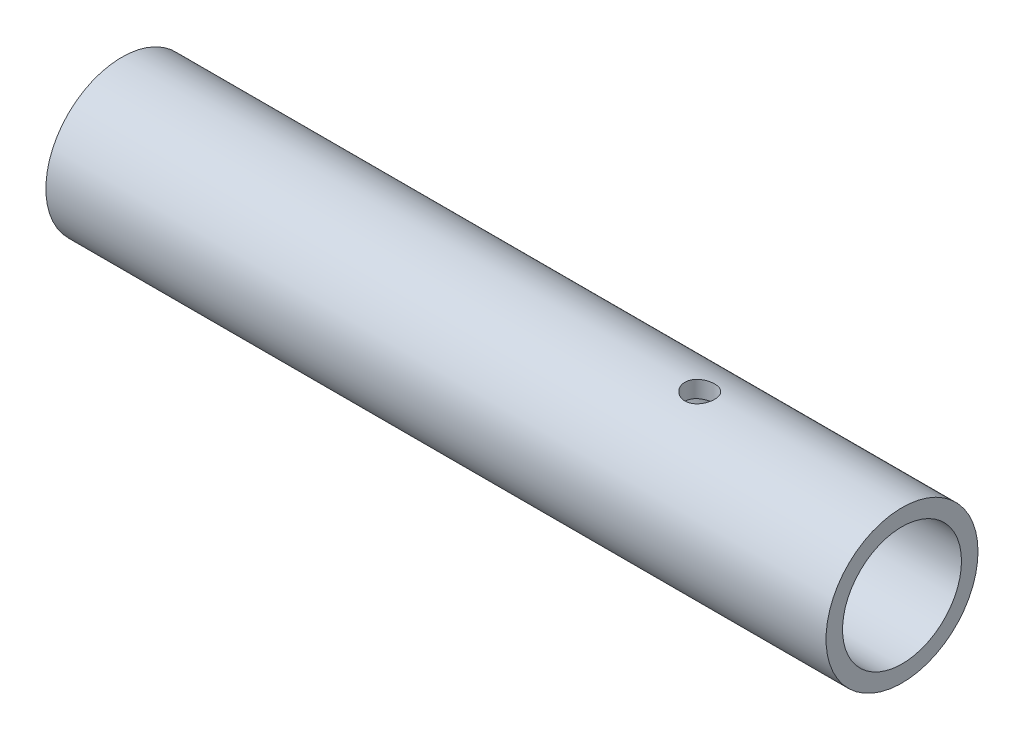
from build123d import *

# Parameters (mm, degrees)
SKETCH1_R               = 16.7005
SKETCH1_R_2             = 13.0683
BOSS_EXTRUDE1_DEPTH     = 254
CUT_EXTRUDE2_DEPTH      = 256.095694594
CUT_EXTRUDE2_DEPTH_BACK = 256.095694594
SKETCH3_R               = 3.2639
CUT_EXTRUDE4_START      = -82.55
SKETCH4_R               = 16.7005
CUT_EXTRUDE4_DEPTH      = 82.55


with BuildPart() as part:
    # Sketch1 → Boss-Extrude1 (new body)
    with BuildSketch(Plane(origin=(0, 0, 0), x_dir=(0, 0, -1), z_dir=(1, 0, 0))):
        Circle(SKETCH1_R)
        Circle(SKETCH1_R_2, mode=Mode.SUBTRACT)
    extrude(amount=BOSS_EXTRUDE1_DEPTH)

    # Sketch3 → Cut-Extrude2 (cut, two sides: drawn at the far end of the back side and taken through both)
    with BuildSketch(Plane(origin=(0, 0, 0), x_dir=(1, 0, 0), z_dir=(0, 1, 0)).offset(-CUT_EXTRUDE2_DEPTH_BACK)):
        with Locations(Location((127, 0, 0), (0, 0, 270))):
            Circle(SKETCH3_R)
    extrude(amount=CUT_EXTRUDE2_DEPTH + CUT_EXTRUDE2_DEPTH_BACK, mode=Mode.SUBTRACT)

    # Sketch4 → Cut-Extrude4 (cut)
    with BuildSketch(Plane(origin=(254, 0, 0), x_dir=(0, 0, -1), z_dir=(1, 0, 0)).offset(CUT_EXTRUDE4_START)):
        Circle(SKETCH4_R)
    extrude(amount=CUT_EXTRUDE4_DEPTH, mode=Mode.SUBTRACT)


solid = part.part
